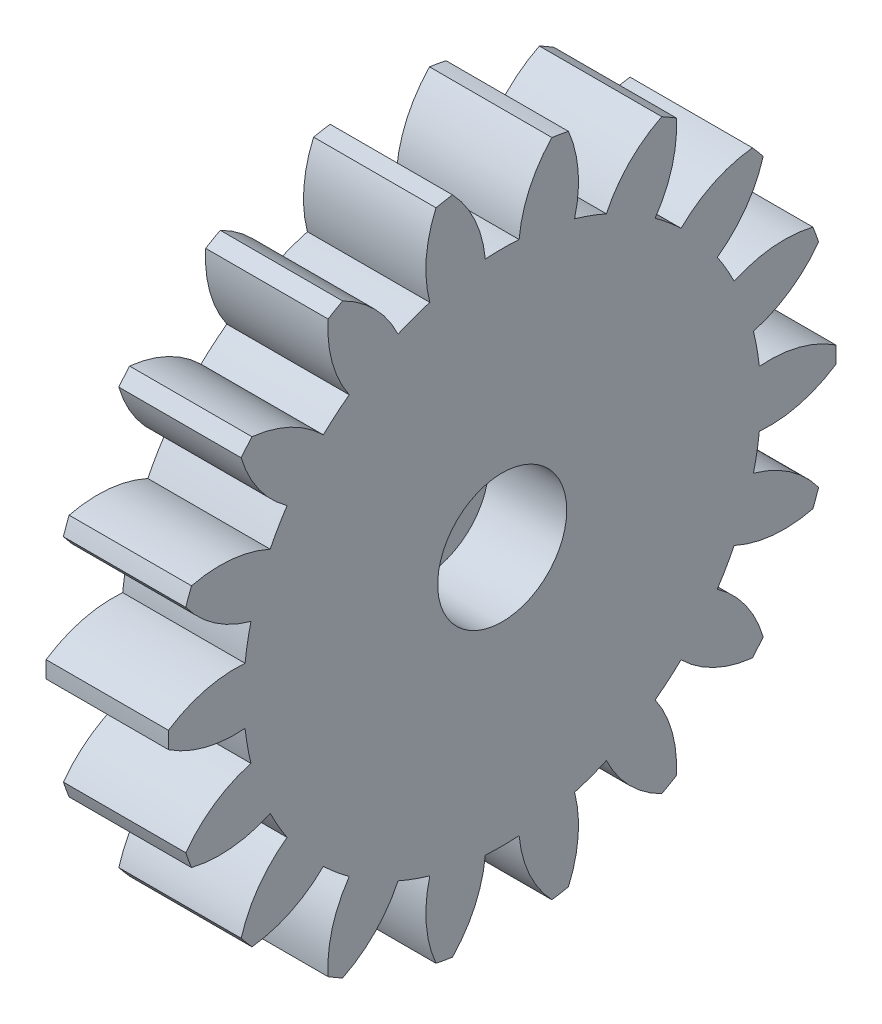
from build123d import *

# Parameters (mm, degrees)
BASPROSKE_W             = 7
BASPROSKE_H             = 15
TOOTHCUT_DEPTH          = 23.338307904
TEETHCUTS_COUNT         = 18
TEETHCUTS_ANGLE         = 340
BORSKE_R                = 2.5
BORE_DEPTH              = 50.0000508
CROQUIS1_R              = 2.9
CORTAR_EXTRUIR1_DEPTH   = 10
CROQUIS4_R              = 3.489132724
SALIENTE_EXTRUIR1_DEPTH = 2
CROQUIS5_R              = 1.9
CORTAR_EXTRUIR3_DEPTH   = 5
CROQUIS6_R              = 21.972687295
CORTAR_EXTRUIR4_DEPTH   = 1.5


with BuildPart() as part:
    # BasProSke → Base-Revolve (revolve)
    with BuildSketch(Plane(origin=(0, 0, 0), x_dir=(1, 0, 0), z_dir=(0, 1, 0)), mode=Mode.PRIVATE) as base_revolve_sk:
        with Locations((3.5, 7.5)):
            Rectangle(BASPROSKE_W, BASPROSKE_H)
    revolve(base_revolve_sk.sketch.rotate(Axis((-10, 0, 0), (1, 0, 0)), 180), axis=Axis((-10, 0, 0), (1, 0, 0)))

    # TooCutSke → ToothCut (cut, through all)
    with BuildSketch(Plane(origin=(0, 0, 0), x_dir=(0, 0, -1), z_dir=(1, 0, 0))):
        with BuildLine():
            ThreePointArc((0.759974923, 11.599129886), (0, 11.624), (-0.759974923, 11.599129886))
            ThreePointArc((-0.759974923, 11.599129886), (-1.229186471, 13.354767823), (-2.254227748, 14.855339189))
            ThreePointArc((-2.254227748, 14.855339189), (0, 15.0254), (2.254227748, 14.855339189))
            ThreePointArc((2.254227748, 14.855339189), (1.229186471, 13.354767823), (0.759974923, 11.599129886))
        make_face()
    toothcut = extrude(amount=TOOTHCUT_DEPTH, mode=Mode.SUBTRACT)

    # TeethCuts: ToothCut ×18 about axis
    teethcuts_axis = Axis((-10, 0, 0), (1, 0, 0))
    for i in range(1, TEETHCUTS_COUNT):
        add(toothcut.rotate(teethcuts_axis, i * TEETHCUTS_ANGLE / (TEETHCUTS_COUNT - 1)), mode=Mode.SUBTRACT)

    # BorSke → Bore (cut, symmetric)
    with BuildSketch(Plane(origin=(0, 0, 0), x_dir=(0, 0, -1), z_dir=(1, 0, 0))):
        with Locations(Location((0, 0, 0), (0, 0, 180))):
            Circle(BORSKE_R)
    extrude(amount=BORE_DEPTH, both=True, mode=Mode.SUBTRACT)

    # Croquis1 → Cortar-Extruir1 (cut)
    with BuildSketch(Plane(origin=(7, 0, 0), x_dir=(0, 0, -1), z_dir=(1, 0, 0))):
        Circle(CROQUIS1_R)
    extrude(amount=-CORTAR_EXTRUIR1_DEPTH, mode=Mode.SUBTRACT)

    # Croquis4 → Saliente-Extruir1 (add, through all)
    with BuildSketch(Plane.ZY.offset(-2)):
        Circle(CROQUIS4_R)
    extrude(amount=SALIENTE_EXTRUIR1_DEPTH)

    # Croquis5 → Cortar-Extruir3 (cut)
    with BuildSketch(Plane(origin=(2, 0, 0), x_dir=(0, 0, -1), z_dir=(1, 0, 0))):
        Circle(CROQUIS5_R)
    extrude(amount=-CORTAR_EXTRUIR3_DEPTH, mode=Mode.SUBTRACT)

    # Croquis6 → Cortar-Extruir4 (cut)
    with BuildSketch(Plane(origin=(7, 0, 0), x_dir=(0, 0, -1), z_dir=(1, 0, 0))):
        Circle(CROQUIS6_R)
    extrude(amount=-CORTAR_EXTRUIR4_DEPTH, mode=Mode.SUBTRACT)


solid = part.part
